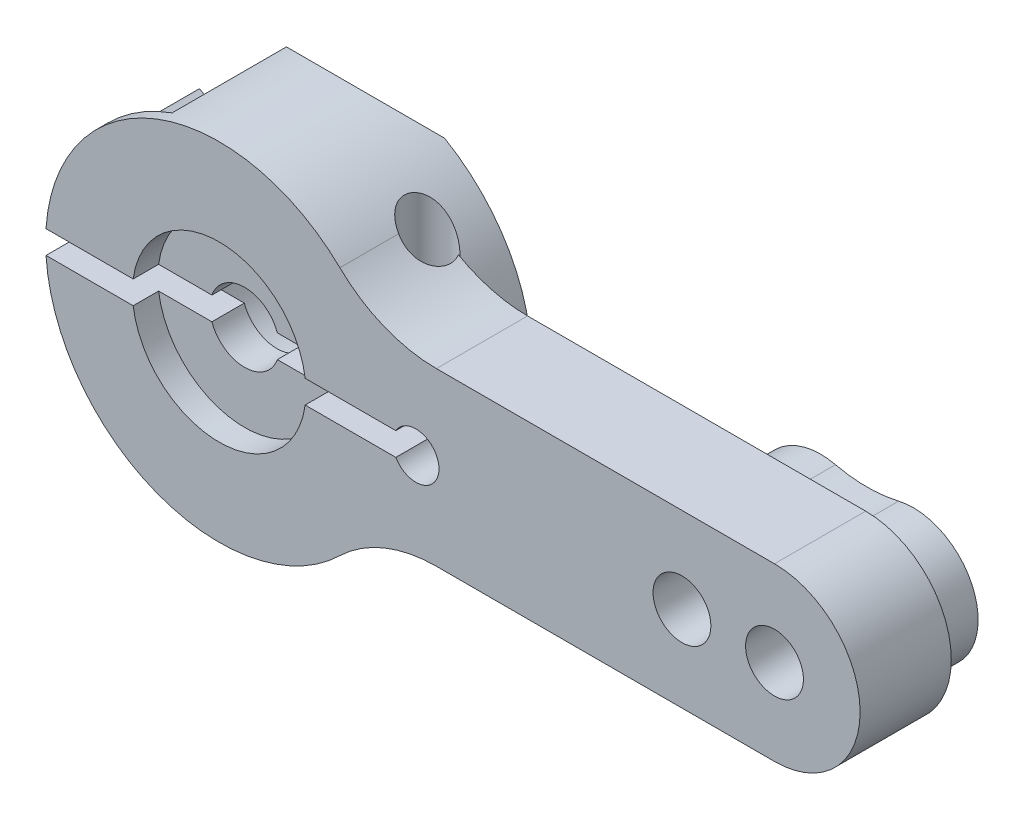
from build123d import *

# Parameters (mm, degrees)
SKETCH_1_R               = 1.25
EXTRUDE_1_DEPTH          = 6
CUT_EXTRUDE_1_DEPTH      = 2.06
SKETCH_1_4_R             = 2.75
CUT_EXTRUDE_2_DEPTH      = 3.5
CUT_EXTRUDE_START        = 6
SKETCH_1_5_R             = 3.75
CUT_EXTRUDE_3_DEPTH      = 1.1
FILLET_1_R               = 6
SKETCH_2_R               = 3
CUT_EXTRUDE_4_DEPTH      = 5.5
CUT_EXTRUDE_5_DEPTH      = 30.317912613
CUT_EXTRUDE_5_DEPTH_BACK = 30.317912613
SKETCH_3_R               = 1
CUT_EXTRUDE_6_DEPTH      = 30.317912659
CUT_EXTRUDE_6_DEPTH_BACK = 30.317912659


with BuildPart() as part:
    # Эскиз1 → Бобышка-Вытянуть1 (new body)
    # profile 1 of 8: a face of its own
    with BuildSketch(Plane.XY):
        with BuildLine():
            ThreePointArc((24, -3.7), (27.7, 0), (24, 3.7))
            Line((24, 3.7), (6.523802572, 3.7))
            ThreePointArc((6.523802572, 3.7), (7.183998475, 2.154104435), (7.483314774, 0.5))
            Line((7.483314774, 0.5), (7.633974596, 0.5))
            ThreePointArc((7.633974596, 0.5), (8.758819045, 0.965925826), (9.5, 0))
            ThreePointArc((9.5, 0), (8.758819045, -0.965925826), (7.633974596, -0.5))
            Line((7.633974596, -0.5), (7.483314774, -0.5))
            ThreePointArc((7.483314774, -0.5), (7.183998475, -2.154104435), (6.523802572, -3.7))
            Line((6.523802572, -3.7), (24, -3.7))
        make_face()
        with BuildLine():
            ThreePointArc((23.363636364, 2.726727218), (26.8, 0), (23.363636364, -2.726727218))
            ThreePointArc((23.363636364, -2.726727218), (22, -2.569714114), (20.636363636, -2.726727218))
            ThreePointArc((20.636363636, -2.726727218), (17.2, 0), (20.636363636, 2.726727218))
            ThreePointArc((20.636363636, 2.726727218), (22, 2.569714114), (23.363636364, 2.726727218))
        make_face(mode=Mode.SUBTRACT)
    # profile 2 of 8: a face of its own
    with BuildSketch(Plane.XY):
        with BuildLine():
            ThreePointArc((20.636363636, 2.726727218), (22, 2.569714114), (23.363636364, 2.726727218))
            ThreePointArc((23.363636364, 2.726727218), (26.8, 0), (23.363636364, -2.726727218))
            ThreePointArc((23.363636364, -2.726727218), (22, -2.569714114), (20.636363636, -2.726727218))
            ThreePointArc((20.636363636, -2.726727218), (17.2, 0), (20.636363636, 2.726727218))
        make_face()
        with Locations((20, 0)):
            Circle(SKETCH_1_R, mode=Mode.SUBTRACT)
        with Locations((24, 0)):
            Circle(SKETCH_1_R, mode=Mode.SUBTRACT)
    # profile 3 of 8: a face of its own
    with BuildSketch(Plane.XY):
        with BuildLine():
            ThreePointArc((7.483314774, 0.5), (7.183998475, 2.154104435), (6.523802572, 3.7))
            ThreePointArc((6.523802572, 3.7), (-1.670378974, 7.311623218), (-7.483314774, 0.5))
            Line((-7.483314774, 0.5), (-3.716517187, 0.5))
            ThreePointArc((-3.716517187, 0.5), (0, 3.75), (3.716517187, 0.5))
            Line((3.716517187, 0.5), (7.483314774, 0.5))
        make_face()
    # profile 4 of 8: a face of its own
    with BuildSketch(Plane.XY):
        with BuildLine():
            ThreePointArc((3.716517187, 0.5), (0, 3.75), (-3.716517187, 0.5))
            Line((-3.716517187, 0.5), (-2.704163457, 0.5))
            ThreePointArc((-2.704163457, 0.5), (0, 2.75), (2.704163457, 0.5))
            Line((2.704163457, 0.5), (3.716517187, 0.5))
        make_face()
    # profile 5 of 8: a face of its own
    with BuildSketch(Plane.XY):
        with BuildLine():
            ThreePointArc((2.704163457, 0.5), (0, 2.75), (-2.704163457, 0.5))
            Line((-2.704163457, 0.5), (-1.414213562, 0.5))
            ThreePointArc((-1.414213562, 0.5), (0, 1.5), (1.414213562, 0.5))
            Line((1.414213562, 0.5), (2.704163457, 0.5))
        make_face()
    # profile 6 of 8: a face of its own
    with BuildSketch(Plane.XY):
        with BuildLine():
            ThreePointArc((-7.483314774, -0.5), (-1.670378974, -7.311623218), (6.523802572, -3.7))
            ThreePointArc((6.523802572, -3.7), (7.183998475, -2.154104435), (7.483314774, -0.5))
            Line((7.483314774, -0.5), (3.716517187, -0.5))
            ThreePointArc((3.716517187, -0.5), (0, -3.75), (-3.716517187, -0.5))
            Line((-3.716517187, -0.5), (-7.483314774, -0.5))
        make_face()
    # profile 7 of 8: a face of its own
    with BuildSketch(Plane.XY):
        with BuildLine():
            Line((-2.704163457, -0.5), (-3.716517187, -0.5))
            ThreePointArc((-3.716517187, -0.5), (0, -3.75), (3.716517187, -0.5))
            Line((3.716517187, -0.5), (2.704163457, -0.5))
            ThreePointArc((2.704163457, -0.5), (0, -2.75), (-2.704163457, -0.5))
        make_face()
    # profile 8 of 8: a face of its own
    with BuildSketch(Plane.XY):
        with BuildLine():
            Line((-1.414213562, -0.5), (-2.704163457, -0.5))
            ThreePointArc((-2.704163457, -0.5), (0, -2.75), (2.704163457, -0.5))
            Line((2.704163457, -0.5), (1.414213562, -0.5))
            ThreePointArc((1.414213562, -0.5), (0, -1.5), (-1.414213562, -0.5))
        make_face()
    extrude(amount=EXTRUDE_1_DEPTH)

    # Эскиз1<3> → Вырез-Вытянуть1 (cut)
    with BuildSketch(Plane.XY):
        with BuildLine():
            ThreePointArc((24, -3.7), (27.7, 0), (24, 3.7))
            Line((24, 3.7), (6.523802572, 3.7))
            ThreePointArc((6.523802572, 3.7), (7.183998475, 2.154104435), (7.483314774, 0.5))
            Line((7.483314774, 0.5), (7.633974596, 0.5))
            ThreePointArc((7.633974596, 0.5), (8.758819045, 0.965925826), (9.5, 0))
            ThreePointArc((9.5, 0), (8.758819045, -0.965925826), (7.633974596, -0.5))
            Line((7.633974596, -0.5), (7.483314774, -0.5))
            ThreePointArc((7.483314774, -0.5), (7.183998475, -2.154104435), (6.523802572, -3.7))
            Line((6.523802572, -3.7), (24, -3.7))
        make_face()
        with BuildLine():
            ThreePointArc((23.363636364, 2.726727218), (26.8, 0), (23.363636364, -2.726727218))
            ThreePointArc((23.363636364, -2.726727218), (22, -2.569714114), (20.636363636, -2.726727218))
            ThreePointArc((20.636363636, -2.726727218), (17.2, 0), (20.636363636, 2.726727218))
            ThreePointArc((20.636363636, 2.726727218), (22, 2.569714114), (23.363636364, 2.726727218))
        make_face(mode=Mode.SUBTRACT)
    extrude(amount=CUT_EXTRUDE_1_DEPTH, mode=Mode.SUBTRACT)

    # Эскиз1<4> → Вырез-Вытянуть2 (cut)
    with BuildSketch(Plane.XY):
        Circle(SKETCH_1_4_R)
    extrude(amount=CUT_EXTRUDE_2_DEPTH, mode=Mode.SUBTRACT)

    # Эскиз1<5> → Вырез-Вытянуть3 (cut)
    with BuildSketch(Plane.XY.offset(CUT_EXTRUDE_START)):
        Circle(SKETCH_1_5_R)
    extrude(amount=-CUT_EXTRUDE_3_DEPTH, mode=Mode.SUBTRACT)

    # Скругление1
    fillet_1_edges = [part.edges().sort_by_distance(p)[0] for p in [
        (6.523802572, 3.7, 4.03),
        (6.523802572, -3.7, 4.03),
    ]]
    fillet(fillet_1_edges, radius=FILLET_1_R)

    # Эскиз2 → Вырез-Вытянуть4 (cut)
    with BuildSketch(Plane.XY):
        with Locations((5.099019514, -5.5)):
            Circle(SKETCH_2_R)
        with Locations((-5.099019514, 5.5)):
            Circle(SKETCH_2_R)
    extrude(amount=CUT_EXTRUDE_4_DEPTH, mode=Mode.SUBTRACT)

    # Эскиз3 → Вырез-Вытянуть5 (cut, two sides: drawn at the far end of the back side and taken through both)
    with BuildSketch(Plane(origin=(0, 0, 0), x_dir=(1, 0, 0), z_dir=(0, 1, 0)).offset(-CUT_EXTRUDE_5_DEPTH_BACK)):
        with Locations(Location((5.5, -2.5, 0), (0, 0, 270))):
            Circle(SKETCH_3_R)
        with Locations(Location((-5.5, -2.5, 0), (0, 0, 270))):
            Circle(SKETCH_3_R)
    extrude(amount=CUT_EXTRUDE_5_DEPTH + CUT_EXTRUDE_5_DEPTH_BACK, mode=Mode.SUBTRACT)

    # Эскиз4 → Вырез-Вытянуть6 (cut, two sides: drawn at the far end of the back side and taken through both)
    with BuildSketch(Plane(origin=(0, 0, 0), x_dir=(0, 0, -1), z_dir=(1, 0, 0)).offset(-CUT_EXTRUDE_6_DEPTH_BACK)):
        Polygon((0, -6.5), (-1, -7.5), (0, -7.5), align=None)
        Polygon((0, 7.5), (0, 6.5), (-1, 7.5), align=None)
    extrude(amount=CUT_EXTRUDE_6_DEPTH + CUT_EXTRUDE_6_DEPTH_BACK, mode=Mode.SUBTRACT)


solid = part.part
